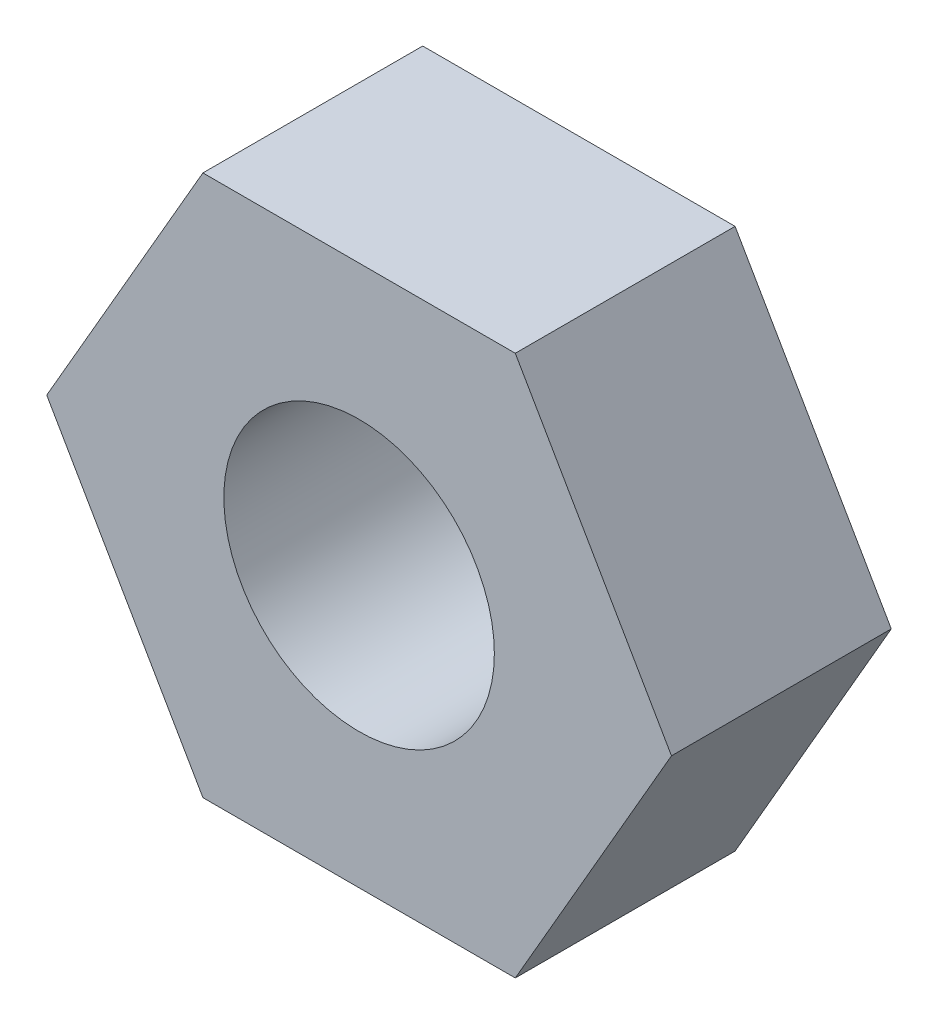
from build123d import *

# Parameters (mm, degrees)
SKETCH1_R = 0.8
NUT_DEPTH = 1.3


with BuildPart() as part:
    # Sketch1 → Nut (new body)
    with BuildSketch(Plane.XY):
        Polygon((1.847520861, 0), (0.923760431, 1.6), (-0.923760431, 1.6), (-1.847520861, 0), (-0.923760431, -1.6), (0.923760431, -1.6), align=None)
        Circle(SKETCH1_R, mode=Mode.SUBTRACT)
    extrude(amount=NUT_DEPTH)


solid = part.part
